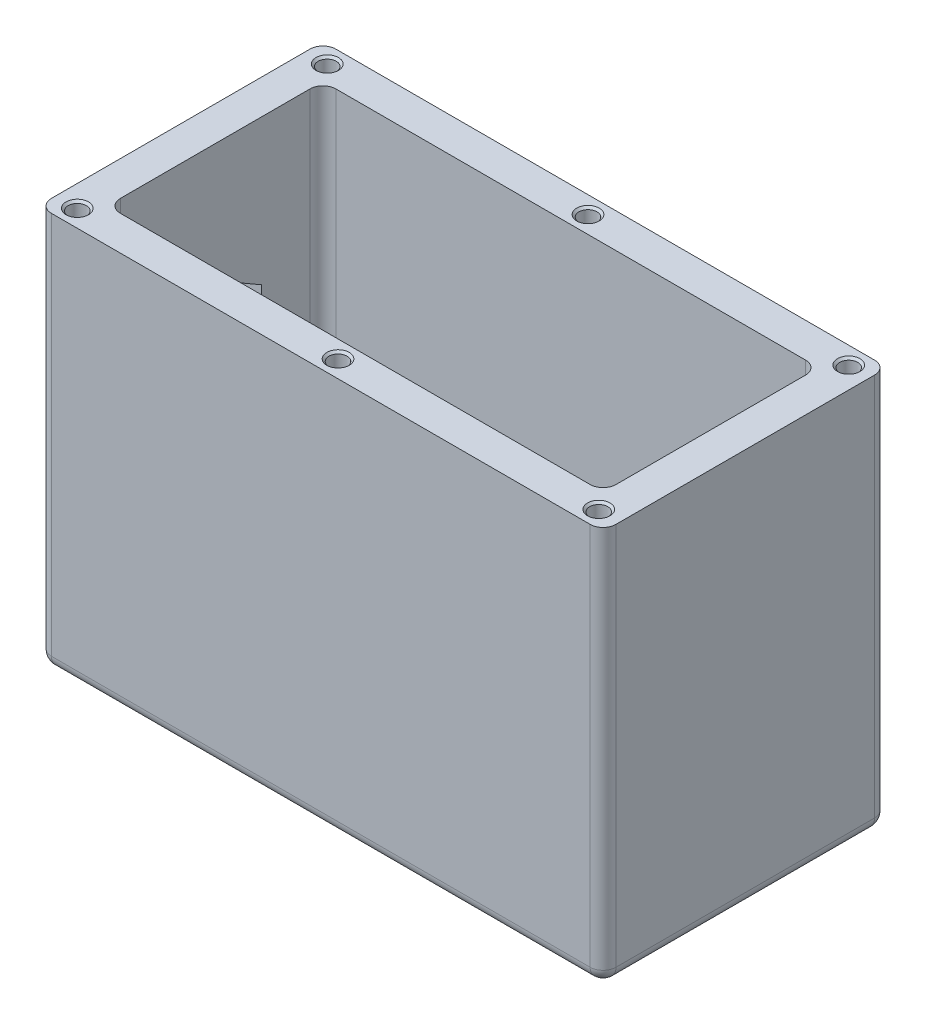
from build123d import *

# Parameters (mm, degrees)
SKETCH1_W           = 131
SKETCH1_H           = 66
BOSS_EXTRUDE1_DEPTH = 92
SKETCH10_W          = 115
SKETCH10_H          = 50
CUT_EXTRUDE7_DEPTH  = 87.5
SKETCH2_R           = 2.25
CUT_EXTRUDE1_DEPTH  = 171.801785705
SKETCH3_R           = 5
CUT_EXTRUDE2_DEPTH  = 171.801785705
SKETCH6_R           = 2.1
CUT_EXTRUDE5_DEPTH  = 7.4
CUT_EXTRUDE9_REACH  = 183.246
SKETCH17_R          = 8
SKETCH19_R          = 1.5
CUT_EXTRUDE12_DEPTH = 20
CUT_EXTRUDE13_DEPTH = 7
SKETCH7_R           = 8.25
SKETCH7_R_2         = 5
CUT_EXTRUDE14_DEPTH = 4.5
SKETCH24_R          = 3.25
CUT_EXTRUDE15_DEPTH = 2
FILLET1_R           = 3
CHAMFER1_SIZE       = 0.5


with BuildPart() as part:
    # Sketch1 → Boss-Extrude1 (new body)
    with BuildSketch(Plane(origin=(0, 0, 0), x_dir=(1, 0, 0), z_dir=(0, 1, 0))):
        with Locations((65.5, -33)):
            Rectangle(SKETCH1_W, SKETCH1_H)
    extrude(amount=BOSS_EXTRUDE1_DEPTH)

    # Sketch10 → Cut-Extrude7 (cut)
    with BuildSketch(Plane(origin=(0, 92, 0), x_dir=(1, 0, 0), z_dir=(0, 1, 0))):
        with Locations((65.5, -33)):
            Rectangle(SKETCH10_W, SKETCH10_H)
    extrude(amount=-CUT_EXTRUDE7_DEPTH, mode=Mode.SUBTRACT)

    # Sketch2 → Cut-Extrude1 (cut, through all)
    with BuildSketch(Plane(origin=(0, 4.5, 0), x_dir=(1, 0, 0), z_dir=(0, 1, 0))):
        with Locations(Location((71, -19, 0), (0, 0, 270))):
            Circle(SKETCH2_R)
        with Locations(Location((111, -19, 0), (0, 0, 270))):
            Circle(SKETCH2_R)
        with Locations(Location((71, -47, 0), (0, 0, 270))):
            Circle(SKETCH2_R)
        with Locations(Location((111, -47, 0), (0, 0, 270))):
            Circle(SKETCH2_R)
    extrude(amount=-CUT_EXTRUDE1_DEPTH, mode=Mode.SUBTRACT)

    # Sketch3 → Cut-Extrude2 (cut, through all)
    with BuildSketch(Plane(origin=(0, 4.5, 0), x_dir=(1, 0, 0), z_dir=(0, 1, 0))):
        with Locations(Location((99.54, -33, 0), (0, 0, 270))):
            Circle(SKETCH3_R)
    extrude(amount=-CUT_EXTRUDE2_DEPTH, mode=Mode.SUBTRACT)

    # Sketch6 → Cut-Extrude5 (cut)
    with BuildSketch(Plane(origin=(0, 92, 0), x_dir=(1, 0, 0), z_dir=(0, 1, 0))):
        with Locations(Location((126, -62, 0), (0, 0, 270))):
            Circle(SKETCH6_R)
        with Locations(Location((5, -62, 0), (0, 0, 270))):
            Circle(SKETCH6_R)
        with Locations(Location((5, -4, 0), (0, 0, 270))):
            Circle(SKETCH6_R)
        with Locations(Location((126, -4, 0), (0, 0, 270))):
            Circle(SKETCH6_R)
        with Locations(Location((65.5, -4, 0), (0, 0, 270))):
            Circle(SKETCH6_R)
        with Locations(Location((65.5, -62, 0), (0, 0, 270))):
            Circle(SKETCH6_R)
    extrude(amount=-CUT_EXTRUDE5_DEPTH, mode=Mode.SUBTRACT)

    # Sketch17 → Cut-Extrude9 (cut, up to next)
    with BuildSketch(Plane(origin=(0, 0, 85), x_dir=(0, 0, -1), z_dir=(1, 0, 0)), mode=Mode.PRIVATE) as cut_extrude9_sk1:
        with Locations(Location((52, 52, 0), (0, 0, 180))):
            Circle(SKETCH17_R)
    cut_extrude9_tool1 = extrude(cut_extrude9_sk1.sketch, amount=CUT_EXTRUDE9_REACH, mode=Mode.PRIVATE) & part.part
    add(cut_extrude9_tool1.solids().sort_by_distance((0, 52, 33))[0], mode=Mode.SUBTRACT)

    # Sketch19 → Cut-Extrude12 (cut)
    with BuildSketch(Plane(origin=(0, 84.6, 0), x_dir=(1, 0, 0), z_dir=(0, 1, 0))):
        with Locations(Location((5, -4, 0), (0, 0, 270))):
            Circle(SKETCH19_R)
        with Locations(Location((126, -4, 0), (0, 0, 270))):
            Circle(SKETCH19_R)
        with Locations(Location((126, -62, 0), (0, 0, 270))):
            Circle(SKETCH19_R)
        with Locations(Location((5, -62, 0), (0, 0, 270))):
            Circle(SKETCH19_R)
        with Locations(Location((65.5, -4, 0), (0, 0, 270))):
            Circle(SKETCH19_R)
        with Locations(Location((65.5, -62, 0), (0, 0, 270))):
            Circle(SKETCH19_R)
    extrude(amount=-CUT_EXTRUDE12_DEPTH, mode=Mode.SUBTRACT)

    # Sketch23 → Cut-Extrude13 (cut)
    with BuildSketch(Plane(origin=(8, 0, 0), x_dir=(0, 0, -1), z_dir=(1, 0, 0))):
        Polygon((-22.2, 58.235382907), (-33, 64.470765814), (-43.8, 58.235382907), (-43.8, 45.764617093), (-33, 39.529234186), (-22.2, 45.764617093), align=None)
    extrude(amount=-CUT_EXTRUDE13_DEPTH, mode=Mode.SUBTRACT)

    # Sketch7 → Cut-Extrude14 (cut)
    with BuildSketch(Plane(origin=(0, 4.5, 0), x_dir=(1, 0, 0), z_dir=(0, 1, 0))):
        with Locations(Location((99.54, -33, 0), (0, 0, 270))):
            Circle(SKETCH7_R)
        with Locations((99.54, -33)):
            Circle(SKETCH7_R_2, mode=Mode.SUBTRACT)
    extrude(amount=-CUT_EXTRUDE14_DEPTH, mode=Mode.SUBTRACT)

    # Sketch24 → Cut-Extrude15 (cut)
    with BuildSketch(Plane(origin=(0, 4.5, 0), x_dir=(1, 0, 0), z_dir=(0, 1, 0))):
        with Locations(Location((71, -19, 0), (0, 0, 270))):
            Circle(SKETCH24_R)
        with Locations(Location((111, -19, 0), (0, 0, 270))):
            Circle(SKETCH24_R)
        with Locations(Location((71, -47, 0), (0, 0, 270))):
            Circle(SKETCH24_R)
        with Locations(Location((111, -47, 0), (0, 0, 270))):
            Circle(SKETCH24_R)
    extrude(amount=-CUT_EXTRUDE15_DEPTH, mode=Mode.SUBTRACT)

    # Fillet1
    fillet1_edges = [part.edges().sort_by_distance(p)[0] for p in [
        (65.5, 4.5, 8),
        (8, 48.25, 8),
        (123, 4.5, 33),
        (123, 48.25, 8),
        (65.5, 4.5, 58),
        (123, 48.25, 58),
        (8, 4.5, 33),
        (8, 48.25, 58),
        (65.5, 0, 0),
        (131, 0, 33),
        (65.5, 0, 66),
        (0, 0, 33),
        (0, 46, 0),
        (131, 46, 0),
        (131, 46, 66),
        (0, 46, 66),
    ]]
    fillet(fillet1_edges, radius=FILLET1_R)

    # Chamfer1
    chamfer1_edges = [part.edges().sort_by_distance(p)[0] for p in [
        (126, 92, 1.9),
        (5, 92, 59.9),
        (65.5, 92, 1.9),
        (65.5, 92, 59.9),
        (5, 92, 1.9),
        (126, 92, 59.9),
    ]]
    chamfer(chamfer1_edges, length=CHAMFER1_SIZE)


solid = part.part
